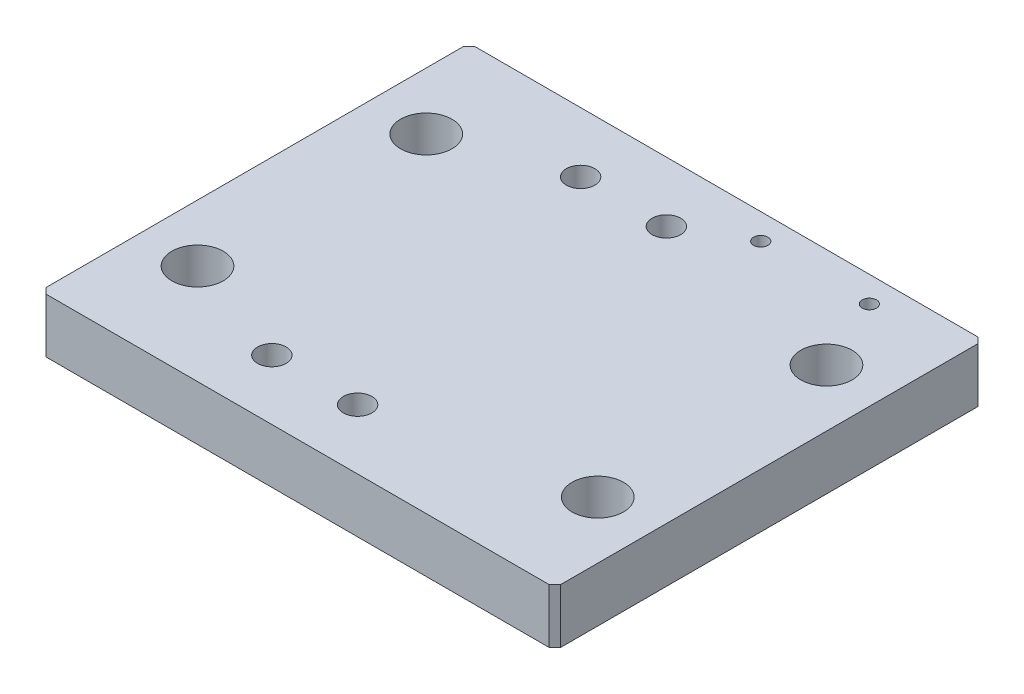
from build123d import *

# Parameters (mm, degrees)
SKETCH1_W                   = 90
SKETCH1_H                   = 75
BOSS_EXTRUDE1_DEPTH         = 9.525
M8_CLEARANCE_HOLE1_D        = 9
FIXED_M6X1_0_TAPPED_HOLE1_D = 5
M3X0_5_TAPPED_HOLE1_D       = 2.5
CHAMFER1_SIZE               = 1


with BuildPart() as part:
    # Sketch1 → Boss-Extrude1 (new body)
    with BuildSketch(Plane(origin=(0, 0, 0), x_dir=(1, 0, 0), z_dir=(0, 1, 0))):
        Rectangle(SKETCH1_W, SKETCH1_H)
    extrude(amount=BOSS_EXTRUDE1_DEPTH)

    # M8 Clearance Hole1 (through all)
    with Locations(Plane(origin=(0, 9.525, 0), x_dir=(1, 0, 0), z_dir=(0, 1, 0))):
        with Locations((-35, 20), (35, 20), (35, -20), (-35, -20)):
            Hole(M8_CLEARANCE_HOLE1_D / 2)

    # Fixed M6x1.0 Tapped Hole1 (through all)
    with Locations(Plane(origin=(0, 9.525, 0), x_dir=(1, 0, 0), z_dir=(0, 1, 0))):
        with Locations((-15, 27), (0, 27), (0, -27), (-15, -27)):
            Hole(FIXED_M6X1_0_TAPPED_HOLE1_D / 2)

    # M3x0.5 Tapped Hole1 (through all)
    with Locations(Plane(origin=(0, 9.525, 0), x_dir=(1, 0, 0), z_dir=(0, 1, 0))):
        with Locations((10.5, 33), (29.5, 33)):
            Hole(M3X0_5_TAPPED_HOLE1_D / 2)

    # Chamfer1
    chamfer1_edges = [part.edges().sort_by_distance(p)[0] for p in [
        (45, 4.7625, 37.5),
        (-45, 4.7625, 37.5),
        (-45, 4.7625, -37.5),
        (45, 4.7625, -37.5),
    ]]
    chamfer(chamfer1_edges, length=CHAMFER1_SIZE)


solid = part.part
